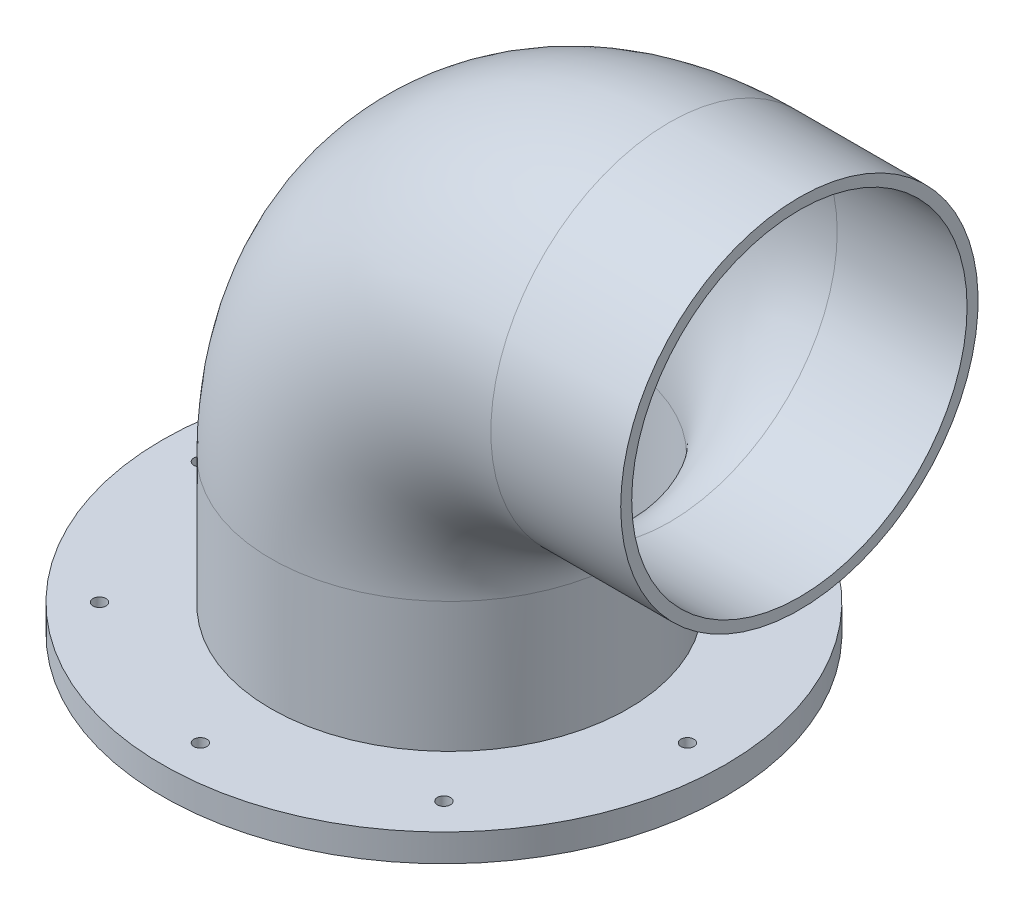
from build123d import *

# Parameters (mm, degrees)
SWEEP5_PROFILE_R    = 41.275
SHELL13_T           = -2.54
SKETCH19_R          = 65
BOSS_EXTRUDE1_DEPTH = 6.35
SKETCH20_R          = 38.1
CUT_EXTRUDE1_DEPTH  = 6.35
SKETCH28_R          = 1.5
CUT_EXTRUDE5_DEPTH  = 10
CIRPATTERN1_COUNT   = 8


with BuildPart() as part:
    # Sweep5: sweep along a path in Sketch4
    with BuildLine(Plane.XY) as sweep5_path:
        Line((1.313416864, 11.5007856), (1.313416864, 41.5007856))
        ThreePointArc((1.313416864, 41.5007856), (16.19239238, 77.421810084), (52.113416864, 92.3007856))
        Line((52.113416864, 92.3007856), (82.113416864, 92.3007856))
    # Sweep5 profile (on start of the path) → Sweep5 (sweep)
    with BuildSketch(Plane(origin=(1.313416864, 11.5007856, 0), x_dir=(1, 0, 0), z_dir=(0, 1, 0))):
        Circle(SWEEP5_PROFILE_R)
    sweep(path=sweep5_path.line)

    # Shell13
    shell13_openings = [part.faces().sort_by_distance(p)[0] for p in [
        (82.113416864, 92.3007856, 0),
        (1.313416864, 11.5007856, 0),
    ]]
    offset(amount=SHELL13_T, openings=shell13_openings, kind=Kind.INTERSECTION)

    # Sketch19 → Boss-Extrude1 (add)
    with BuildSketch(Plane.XZ.offset(-11.5007856)):
        Circle(SKETCH19_R)
    extrude(amount=BOSS_EXTRUDE1_DEPTH)

    # Sketch20 → Cut-Extrude1 (cut)
    with BuildSketch(Plane(origin=(0, 5.1507856, 0), x_dir=(-1, 0, 0), z_dir=(0, -1, 0))):
        with Locations(Location((0, 0, 0), (0, 0, 180))):
            Circle(SKETCH20_R)
    extrude(amount=-CUT_EXTRUDE1_DEPTH, mode=Mode.SUBTRACT)

    # Sketch28 → Cut-Extrude5 (cut)
    with BuildSketch(Plane.XZ.offset(-5.1507856)):
        with Locations((0, 56.25)):
            Circle(SKETCH28_R)
    cut_extrude5 = extrude(amount=-CUT_EXTRUDE5_DEPTH, mode=Mode.SUBTRACT)

    # CirPattern1: Cut-Extrude5 ×8 about axis
    cirpattern1_axis = Axis((0, 0, 0), (0, 1, 0))
    for i in range(1, CIRPATTERN1_COUNT):
        add(cut_extrude5.rotate(cirpattern1_axis, i * 360 / CIRPATTERN1_COUNT), mode=Mode.SUBTRACT)


solid = part.part
